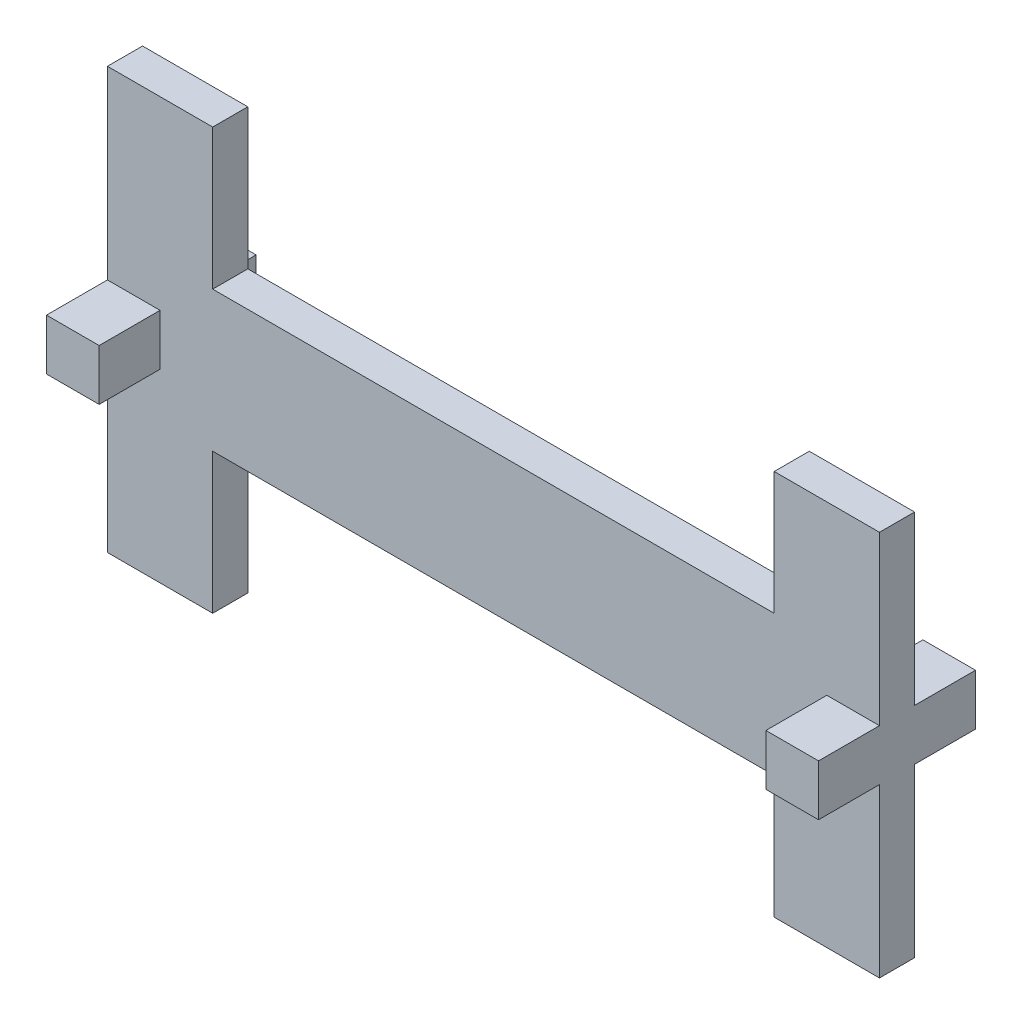
from build123d import *

# Parameters (mm, degrees)
SKETCH_1_W          = 220
SKETCH_1_H          = 120
EXTRUDE_1_DEPTH     = 10
CUT_EXTRUDE_1_DEPTH = 10
SKETCH_5_W          = 44.73
SKETCH_5_H          = 14.54
EXTRUDE_2_DEPTH     = 15


with BuildPart() as part:
    # 草图1 → 凸台-拉伸1 (new body)
    with BuildSketch(Plane.XY):
        with Locations((110, 60)):
            Rectangle(SKETCH_1_W, SKETCH_1_H)
    extrude(amount=EXTRUDE_1_DEPTH)

    # 草图2 → 切除-拉伸1 (cut)
    with BuildSketch(Plane.XY.offset(10)):
        Polygon((220, 120), (30, 120), (30, 80), (190, 80), (190, 115), (220, 115), align=None)
        Polygon((220, 0), (220, 5), (190, 5), (190, 40), (30, 40), (30, 0), align=None)
    extrude(amount=-CUT_EXTRUDE_1_DEPTH, mode=Mode.SUBTRACT)

    # 草图5 → 凸台-拉伸2 (add)
    with BuildSketch(Plane(origin=(220, 0, 0), x_dir=(0, 0, -1), z_dir=(1, 0, 0))):
        with Locations((-5, 60)):
            Rectangle(SKETCH_5_W, SKETCH_5_H)
    extrude_2 = extrude(amount=-EXTRUDE_2_DEPTH)

    # 镜向1: 凸台-拉伸2 across plane
    add(extrude_2.mirror(Plane(origin=(110, 0, 0), x_dir=(0, 0, 1), z_dir=(1, 0, 0))))


solid = part.part
